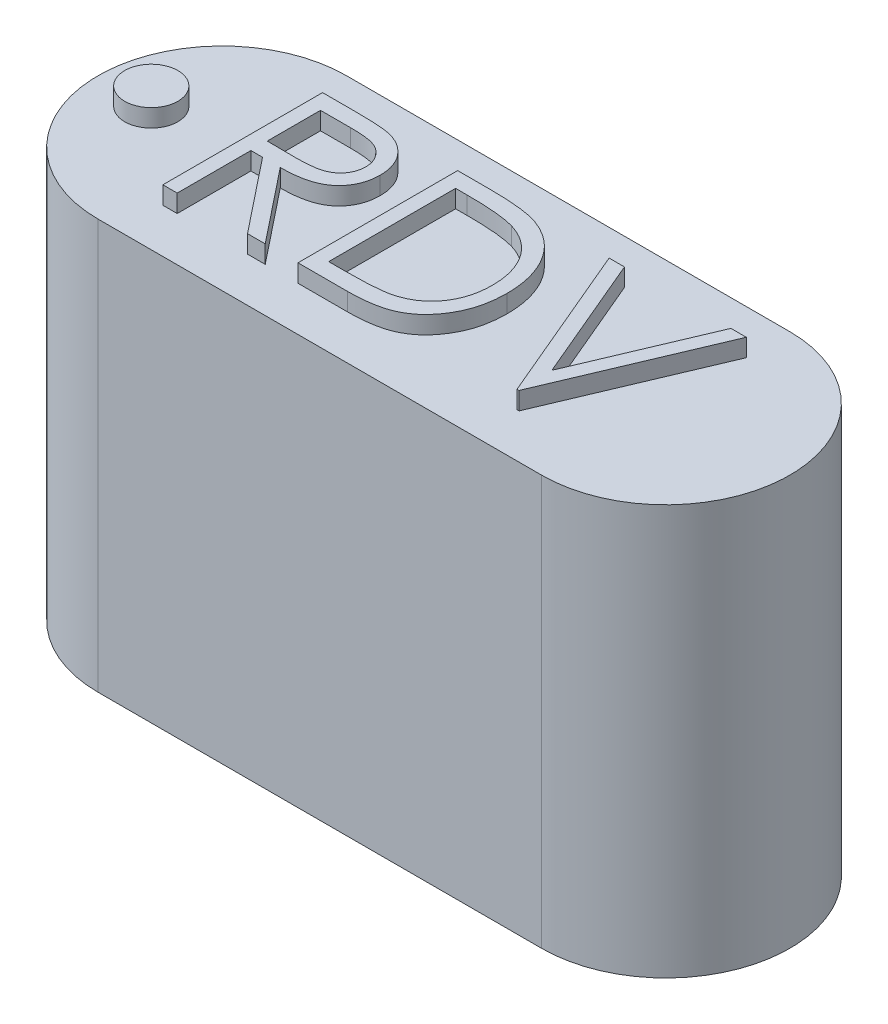
from build123d import *

# Parameters (mm, degrees)
BOSS_EXTRUDE1_DEPTH       = 23.1
BOSS_EXTRUDE3_DEPTH       = 1
SKETCH8_R                 = 1.5
BOSS_EXTRUDE4_DEPTH       = 1
M8_TAPPED_HOLE1_D         = 6.8
M8_TAPPED_HOLE1_DEPTH     = 13.75
M8_TAPPED_HOLE1_TIP       = 2.042926105
F_4_0MM_DOWEL_HOLE1_D     = 4
F_4_0MM_DOWEL_HOLE1_DEPTH = 15
F_4_0MM_DOWEL_HOLE1_TIP   = 1.201721238
F_4_0MM_DOWEL_HOLE2_D     = 4
F_4_0MM_DOWEL_HOLE2_DEPTH = 15
F_4_0MM_DOWEL_HOLE2_TIP   = 1.201721238


with BuildPart() as part:
    # Sketch1 → Boss-Extrude1 (new body)
    with BuildSketch(Plane(origin=(0, 0, 0), x_dir=(1, 0, 0), z_dir=(0, 1, 0))):
        with BuildLine():
            Line((0, 7), (25, 7))
            ThreePointArc((25, 7), (32, 0), (25, -7))
            Line((25, -7), (0, -7))
            ThreePointArc((0, -7), (-7, 0), (0, 7))
        make_face()
    extrude(amount=BOSS_EXTRUDE1_DEPTH)

    # Sketch6 → Boss-Extrude3 (add)
    # profile 1 of 3: a face of its own
    with BuildSketch(Plane(origin=(0, 23.1, 0), x_dir=(1, 0, 0), z_dir=(0, 1, 0))):
        with BuildLine():
            Line((1.153846154, 4.5), (2.954927885, 4.5))
            add(Edge.make_bspline(
                [(2.954927885, 4.5), (3.075119358, 4.499599922), (3.305900301, 4.498831727), (3.636517282, 4.494548337), (3.936929817, 4.482271422), (4.206980832, 4.471706493), (4.446665374, 4.452441501), (4.656718407, 4.434028409), (4.836172486, 4.40992471), (4.944804675, 4.387539336), (4.993990385, 4.377403846)],
                knots=[0, 0, 0, 0, 1.410062039, 2.707475311, 3.878576406, 4.937260626, 5.877586885, 6.699081471, 7.410979367, 8, 8, 8, 8], degree=3))
            add(Edge.make_bspline(
                [(4.993990385, 4.377403846), (5.05983599, 4.361135021), (5.190122534, 4.328944429), (5.377708418, 4.260905455), (5.556459537, 4.182169278), (5.725633371, 4.08969114), (5.884382548, 3.982784563), (6.034343919, 3.863295106), (6.176197967, 3.731876576), (6.304207874, 3.585215555), (6.424908292, 3.431350245), (6.526707617, 3.264969156), (6.614461422, 3.090982371), (6.684328466, 2.907620439), (6.740586112, 2.716661597), (6.780253585, 2.51637612), (6.804042353, 2.30767647), (6.806464267, 2.165327562), (6.807692308, 2.093149038)],
                knots=[0, 0, 0, 0, 1.027469482, 2.033020251, 3.019912614, 3.986113645, 4.951240523, 5.91722682, 6.890402269, 7.87763091, 8.8651537, 9.85103654, 10.82876324, 11.815024772, 12.821070561, 13.842952187, 14.906261191, 16, 16, 16, 16], degree=3))
            add(Edge.make_bspline(
                [(6.807692308, 2.093149038), (6.803914884, 1.973230198), (6.796544152, 1.739237481), (6.727822457, 1.399652357), (6.615254263, 1.082879834), (6.460137234, 0.789318765), (6.26260144, 0.524691391), (6.025194834, 0.292258792), (5.747784976, 0.097756159), (5.489538163, -0.037122481), (5.261415936, -0.123504247), (5.073615988, -0.184283455), (4.868758046, -0.231242794), (4.6488049, -0.273311705), (4.412841215, -0.305073204), (4.161432542, -0.328335876), (3.894399581, -0.342874858), (3.710956259, -0.345040014), (3.616586538, -0.346153846)],
                knots=[0, 0, 0, 0, 1.260483769, 2.459530307, 3.627416485, 4.787058657, 5.939039949, 7.08810263, 8.267026773, 9.491475466, 10.141966685, 10.831826277, 11.566392101, 12.351337768, 13.187381173, 14.07005841, 15.007169909, 16, 16, 16, 16], degree=3))
            Line((3.616586538, -0.346153846), (6.923076923, -4.5))
            Line((6.923076923, -4.5), (5.924278846, -4.5))
            Line((5.924278846, -4.5), (2.617788462, -0.346153846))
            Line((2.617788462, -0.346153846), (1.961538462, -0.346153846))
            Line((1.961538462, -0.346153846), (1.961538462, -4.5))
            Line((1.961538462, -4.5), (1.153846154, -4.5))
            Line((1.153846154, -4.5), (1.153846154, 4.5))
        make_face()
        with BuildLine():
            Line((1.961538462, 3.576923077), (1.961538462, 0.576923077))
            Line((1.961538462, 0.576923077), (3.609375, 0.564302885))
            add(Edge.make_bspline(
                [(3.609375, 0.564302885), (3.686312243, 0.564268848), (3.835438533, 0.564202874), (4.051183099, 0.574472584), (4.252063387, 0.586155403), (4.437311035, 0.604025148), (4.6070088, 0.627055047), (4.761071863, 0.655862721), (4.89975171, 0.689425168), (5.061490809, 0.741372205), (5.242099033, 0.823673395), (5.43837993, 0.943413249), (5.605528798, 1.094019555), (5.746746158, 1.266237014), (5.860221839, 1.455587368), (5.940224265, 1.659800889), (5.990990545, 1.873722141), (5.996978233, 2.020751561), (6, 2.094951923)],
                knots=[0, 0, 0, 0, 1.146690395, 2.22261258, 3.21895312, 4.145990853, 4.996080663, 5.770904154, 6.481378293, 7.121626537, 8.300444488, 9.431385265, 10.535395872, 11.636531494, 12.74115979, 13.810798291, 14.895190096, 16, 16, 16, 16], degree=3))
            add(Edge.make_bspline(
                [(6, 2.094951923), (5.996908831, 2.167328827), (5.990783263, 2.310753441), (5.940772144, 2.520725781), (5.856199449, 2.718897939), (5.742227981, 2.904463757), (5.603373011, 3.072907078), (5.440555778, 3.217028329), (5.258228133, 3.335955524), (5.08781648, 3.411952502), (4.935499934, 3.458546411), (4.803252237, 3.491335118), (4.653822723, 3.517678038), (4.486485829, 3.53878448), (4.301955921, 3.556925765), (4.099299961, 3.569144625), (3.879862526, 3.576380275), (3.727770418, 3.576737932), (3.649038462, 3.576923077)],
                knots=[0, 0, 0, 0, 1.101028733, 2.181837193, 3.264309656, 4.369019818, 5.486613113, 6.575447106, 7.666700264, 8.788928104, 9.402425223, 10.0903467, 10.862060571, 11.710948788, 12.657782767, 13.684531032, 14.801375019, 16, 16, 16, 16], degree=3))
            Line((3.649038462, 3.576923077), (1.961538462, 3.576923077))
        make_face(mode=Mode.SUBTRACT)
    # profile 2 of 3: a face of its own
    with BuildSketch(Plane(origin=(0, 23.1, 0), x_dir=(1, 0, 0), z_dir=(0, 1, 0))):
        with BuildLine():
            Line((8.769230769, -4.5), (8.769230769, 4.5))
            Line((8.769230769, 4.5), (10.586538462, 4.5))
            add(Edge.make_bspline(
                [(10.586538462, 4.5), (10.744601574, 4.498861963), (11.049978685, 4.496663281), (11.491267835, 4.482722561), (11.899568939, 4.458061363), (12.273539148, 4.422139724), (12.614205122, 4.378031924), (12.920612971, 4.32274517), (13.194347053, 4.257461303), (13.362697043, 4.201801574), (13.442307692, 4.175480769)],
                knots=[0, 0, 0, 0, 1.314313732, 2.53924729, 3.670748893, 4.714932338, 5.66265055, 6.526160246, 7.303039223, 8, 8, 8, 8], degree=3))
            add(Edge.make_bspline(
                [(13.442307692, 4.175480769), (13.546437022, 4.135801812), (13.752334374, 4.057343684), (14.045495546, 3.909341767), (14.321475051, 3.741650933), (14.581752852, 3.554050144), (14.820383548, 3.341227533), (15.046689568, 3.112223599), (15.251413144, 2.858710724), (15.438891619, 2.585946469), (15.607926172, 2.297144049), (15.754855435, 1.99285377), (15.87687999, 1.674620949), (15.978176858, 1.343330568), (16.058010606, 0.998254168), (16.11247843, 0.638989941), (16.148403833, 0.26695774), (16.152014251, 0.014509119), (16.153846154, -0.113581731)],
                knots=[0, 0, 0, 0, 0.984719456, 1.947108742, 2.898477687, 3.838006223, 4.779231079, 5.722358779, 6.681677486, 7.655904652, 8.64651281, 9.637519902, 10.640069247, 11.656948941, 12.698408672, 13.768548281, 14.867775369, 16, 16, 16, 16], degree=3))
            add(Edge.make_bspline(
                [(16.153846154, -0.113581731), (16.152228809, -0.224824915), (16.149041662, -0.44404123), (16.120423421, -0.767117819), (16.078827169, -1.080609859), (16.014427804, -1.383024516), (15.936249912, -1.677011362), (15.83605638, -1.959437134), (15.72127939, -2.232892643), (15.587436845, -2.493680439), (15.440501855, -2.740751967), (15.282817372, -2.973660468), (15.114551584, -3.189082467), (14.934099957, -3.387670327), (14.7437944, -3.569124671), (14.542388979, -3.734961282), (14.329363991, -3.88193528), (14.105673561, -4.01582213), (13.864792086, -4.13261733), (13.602157001, -4.231437355), (13.316648258, -4.313328652), (13.008966655, -4.381653812), (12.678580569, -4.435852591), (12.325166085, -4.4721776), (11.949266198, -4.496742284), (11.691148087, -4.49889301), (11.558293269, -4.5)],
                knots=[0, 0, 0, 0, 1.105936401, 2.179363191, 3.223086493, 4.248585256, 5.251745608, 6.245858792, 7.225916811, 8.198733463, 9.158002045, 10.082870192, 10.993790845, 11.873723703, 12.748670949, 13.606408763, 14.465103618, 15.319838547, 16.196477973, 17.123216899, 18.106603292, 19.147568657, 20.255746949, 21.433717677, 22.679120308, 24, 24, 24, 24], degree=3))
            Line((11.558293269, -4.5), (8.769230769, -4.5))
        make_face()
        with BuildLine():
            Line((9.576923077, -3.576923077), (10.609975962, -3.576923077))
            add(Edge.make_bspline(
                [(10.609975962, -3.576923077), (10.758420343, -3.576285115), (11.043933254, -3.57505808), (11.45448239, -3.564290986), (11.829600838, -3.546697433), (12.169341862, -3.522075804), (12.473513639, -3.489499365), (12.742751853, -3.453178187), (12.976173945, -3.407927599), (13.117421069, -3.366910846), (13.182692308, -3.347956731)],
                knots=[0, 0, 0, 0, 1.375205317, 2.645023457, 3.804390687, 4.853969522, 5.800190428, 6.637939096, 7.370582563, 8, 8, 8, 8], degree=3))
            add(Edge.make_bspline(
                [(13.182692308, -3.347956731), (13.264845239, -3.319024152), (13.42718888, -3.26185005), (13.660883099, -3.157558921), (13.878829682, -3.03402217), (14.08482689, -2.896702037), (14.275952576, -2.740755175), (14.454471732, -2.569572632), (14.620024935, -2.382283211), (14.770901727, -2.179119367), (14.90592308, -1.961345606), (15.022849099, -1.731102891), (15.125324466, -1.490913951), (15.205755133, -1.2370904), (15.268795206, -0.971901392), (15.313447261, -0.695328273), (15.341256552, -0.407422691), (15.344500276, -0.211602943), (15.346153846, -0.111778846)],
                knots=[0, 0, 0, 0, 0.998632004, 1.973411704, 2.929992603, 3.868527914, 4.809262121, 5.754881198, 6.702106254, 7.672490631, 8.653608572, 9.636854334, 10.631411391, 11.644891563, 12.686317036, 13.754757253, 14.855430412, 16, 16, 16, 16], degree=3))
            add(Edge.make_bspline(
                [(15.346153846, -0.111778846), (15.344833964, -0.006521325), (15.342241045, 0.200258006), (15.309649961, 0.503662651), (15.262023104, 0.795470038), (15.193150768, 1.075699683), (15.105385651, 1.344898303), (14.995856573, 1.601577044), (14.870713837, 1.848446706), (14.721819543, 2.079809361), (14.558750874, 2.298620213), (14.377779184, 2.49907571), (14.181779657, 2.681632483), (13.972890044, 2.849133572), (13.745223217, 2.994840167), (13.504142298, 3.125177347), (13.246110572, 3.235789639), (13.066592211, 3.294621001), (12.975360577, 3.324519231)],
                knots=[0, 0, 0, 0, 1.122418816, 2.205001699, 3.251619955, 4.274784885, 5.280384055, 6.268708349, 7.249350384, 8.229342522, 9.199999885, 10.157847722, 11.105861043, 12.055065948, 13.010012805, 13.98527497, 14.976112212, 16, 16, 16, 16], degree=3))
            add(Edge.make_bspline(
                [(12.975360577, 3.324519231), (12.899886201, 3.345390045), (12.739406968, 3.389767123), (12.477534061, 3.438175224), (12.182809391, 3.480872507), (11.853924445, 3.517021751), (11.491254122, 3.542960578), (11.094519496, 3.562429672), (10.663549084, 3.575561013), (10.364793997, 3.576457689), (10.209735577, 3.576923077)],
                knots=[0, 0, 0, 0, 0.674548936, 1.434276114, 2.292660221, 3.240891867, 4.284742987, 5.42552168, 6.663806718, 8, 8, 8, 8], degree=3))
            Line((10.209735577, 3.576923077), (9.576923077, 3.576923077))
            Line((9.576923077, 3.576923077), (9.576923077, -3.576923077))
        make_face(mode=Mode.SUBTRACT)
    # profile 3 of 3: a face of its own
    with BuildSketch(Plane(origin=(0, 23.1, 0), x_dir=(1, 0, 0), z_dir=(0, 1, 0))):
        Polygon((17.307692308, 4.5), (18.173076923, 4.5), (21.173076923, -2.592548077), (24.173076923, 4.5), (25.038461538, 4.5), (21.230769231, -4.5), (21.115384615, -4.5), align=None)
    extrude(amount=BOSS_EXTRUDE3_DEPTH)

    # Sketch8 → Boss-Extrude4 (add)
    with BuildSketch(Plane(origin=(0, 23.1, 0), x_dir=(1, 0, 0), z_dir=(0, 1, 0))):
        with Locations(Location((-4, 0, 0), (0, 0, 270))):
            Circle(SKETCH8_R)
    extrude(amount=BOSS_EXTRUDE4_DEPTH)

    # M8 Tapped Hole1
    with Locations(Plane(origin=(12.5, 0, 0), x_dir=(0, 0, -1), z_dir=(0, -1, 0))):
        with Locations((0, 0)):
            Hole(M8_TAPPED_HOLE1_D / 2, depth=M8_TAPPED_HOLE1_DEPTH)
            with Locations((0, 0, -(M8_TAPPED_HOLE1_DEPTH + M8_TAPPED_HOLE1_TIP / 2))):  # 118° drill point
                Cone(0, M8_TAPPED_HOLE1_D / 2, M8_TAPPED_HOLE1_TIP, mode=Mode.SUBTRACT)

    # Ø4.0mm Dowel Hole1
    with Locations(Plane(origin=(2.5, 0, 0), x_dir=(0, 0, -1), z_dir=(0, -1, 0))):
        with Locations((0, 0)):
            Hole(F_4_0MM_DOWEL_HOLE1_D / 2, depth=F_4_0MM_DOWEL_HOLE1_DEPTH)
            with Locations((0, 0, -(F_4_0MM_DOWEL_HOLE1_DEPTH + F_4_0MM_DOWEL_HOLE1_TIP / 2))):  # 118° drill point
                Cone(0, F_4_0MM_DOWEL_HOLE1_D / 2, F_4_0MM_DOWEL_HOLE1_TIP, mode=Mode.SUBTRACT)

    # Ø4.0mm Dowel Hole2
    with Locations(Plane(origin=(22.5, 0, 0), x_dir=(0, 0, -1), z_dir=(0, -1, 0))):
        with Locations((0, 0)):
            Hole(F_4_0MM_DOWEL_HOLE2_D / 2, depth=F_4_0MM_DOWEL_HOLE2_DEPTH)
            with Locations((0, 0, -(F_4_0MM_DOWEL_HOLE2_DEPTH + F_4_0MM_DOWEL_HOLE2_TIP / 2))):  # 118° drill point
                Cone(0, F_4_0MM_DOWEL_HOLE2_D / 2, F_4_0MM_DOWEL_HOLE2_TIP, mode=Mode.SUBTRACT)


solid = part.part
